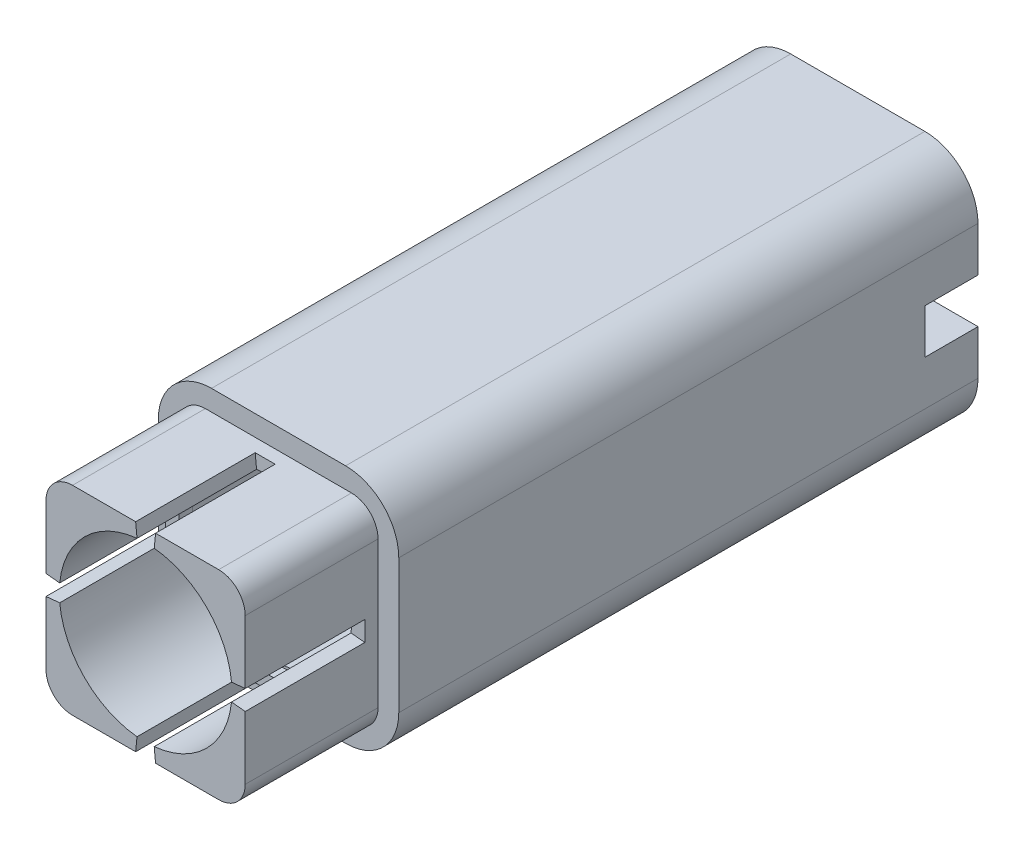
from build123d import *

# Parameters (mm, degrees)
BOSS_EXTRUDE1_DEPTH = 43.61
SKETCH3_R           = 6.5
BOSS_EXTRUDE2_DEPTH = 10
CUT_EXTRUDE3_DEPTH  = 4
CUT_EXTRUDE6_DEPTH  = 2
CUT_EXTRUDE7_DEPTH  = 9
CIRPATTERN1_COUNT   = 4
SKETCH12_R          = 6.5
CUT_EXTRUDE8_DEPTH  = 37.61


with BuildPart() as part:
    # Sketch1 → Boss-Extrude1 (new body)
    with BuildSketch(Plane.XY):
        with BuildLine():
            Line((-5.05, 9.05), (5.05, 9.05))
            ThreePointArc((5.05, 9.05), (7.878427125, 7.878427125), (9.05, 5.05))
            Line((9.05, 5.05), (9.05, -5.05))
            ThreePointArc((9.05, -5.05), (7.878427125, -7.878427125), (5.05, -9.05))
            Line((5.05, -9.05), (-5.05, -9.05))
            ThreePointArc((-5.05, -9.05), (-7.878427125, -7.878427125), (-9.05, -5.05))
            Line((-9.05, -5.05), (-9.05, 5.05))
            ThreePointArc((-9.05, 5.05), (-7.878427125, 7.878427125), (-5.05, 9.05))
        make_face()
    extrude(amount=BOSS_EXTRUDE1_DEPTH)

    # Sketch3 → Boss-Extrude2 (add)
    with BuildSketch(Plane.XY.offset(43.61)):
        with BuildLine():
            Line((-5.509134554, -7.499739888), (5.490865446, -7.499739888))
            ThreePointArc((5.490865446, -7.499739888), (6.905079008, -6.91395345), (7.490865446, -5.499739888))
            Line((7.490865446, -5.499739888), (7.490865446, 5.500260112))
            ThreePointArc((7.490865446, 5.500260112), (6.905079008, 6.914473675), (5.490865446, 7.500260112))
            Line((5.490865446, 7.500260112), (-5.509134554, 7.500260112))
            ThreePointArc((-5.509134554, 7.500260112), (-6.923348116, 6.914473675), (-7.509134554, 5.500260112))
            Line((-7.509134554, 5.500260112), (-7.509134554, -5.499739888))
            ThreePointArc((-7.509134554, -5.499739888), (-6.923348116, -6.91395345), (-5.509134554, -7.499739888))
        make_face()
        with Locations((-0.009134554, 0.000260112)):
            Circle(SKETCH3_R, mode=Mode.SUBTRACT)
    extrude(amount=BOSS_EXTRUDE2_DEPTH)

    # Sketch6 → Cut-Extrude3 (cut)
    with BuildSketch(Plane.XY):
        with BuildLine():
            Line((-2, -1.68), (2, -1.68))
            Line((2, -1.68), (9.05, -1.68))
            Line((9.05, -1.68), (9.05, 1.68))
            Line((9.05, 1.68), (2, 1.68))
            Line((2, 1.68), (-2, 1.68))
            ThreePointArc((-2, 1.68), (-2.914827203, 0), (-2, -1.68))
        make_face()
    extrude(amount=CUT_EXTRUDE3_DEPTH, mode=Mode.SUBTRACT)

    # Sketch10 → Cut-Extrude6 (cut)
    with BuildSketch(Plane(origin=(0, 0, 4), x_dir=(-1, 0, 0), z_dir=(0, 0, -1))):
        with BuildLine():
            Line((-2.7, 1.68), (2, 1.68))
            ThreePointArc((2, 1.68), (2.914827203, 0), (2, -1.68))
            Line((2, -1.68), (-2.7, -1.68))
            Line((-2.7, -1.68), (-2.7, 1.68))
        make_face()
    extrude(amount=-CUT_EXTRUDE6_DEPTH, mode=Mode.SUBTRACT)

    # Sketch11 → Cut-Extrude7 (cut)
    with BuildSketch(Plane.XY.offset(53.61)):
        Polygon((0, 0), (7.490865446, 0.75), (7.490865446, -0.75), align=None)
    cut_extrude7 = extrude(amount=-CUT_EXTRUDE7_DEPTH, mode=Mode.SUBTRACT)

    # CirPattern1: Cut-Extrude7 ×4 about axis
    cirpattern1_axis = Axis((-0.009134554, 0.000260112, 0), (0, 0, 1))
    for i in range(1, CIRPATTERN1_COUNT):
        add(cut_extrude7.rotate(cirpattern1_axis, i * 360 / CIRPATTERN1_COUNT), mode=Mode.SUBTRACT)

    # Sketch12 → Cut-Extrude8 (cut)
    with BuildSketch(Plane.XY.offset(43.61)):
        with Locations((0, 0.192488852)):
            Circle(SKETCH12_R)
    extrude(amount=-CUT_EXTRUDE8_DEPTH, mode=Mode.SUBTRACT)


solid = part.part
